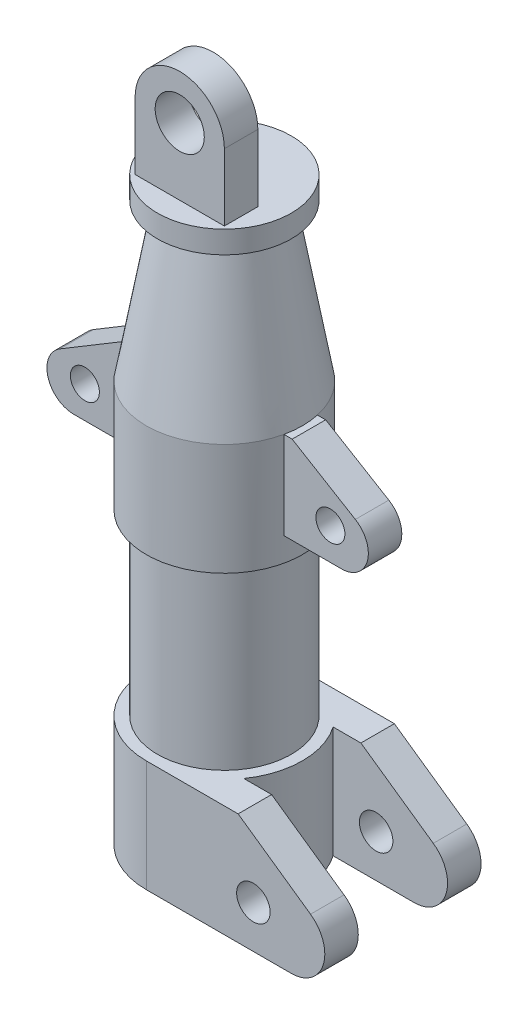
from build123d import *

# Parameters (mm, degrees)
SKETCH2_R           = 7.5
BOSS_EXTRUDE1_DEPTH = 15
SKETCH3_R           = 6.5
BOSS_EXTRUDE2_DEPTH = 7.5
SKETCH4_R           = 11
BOSS_EXTRUDE3_DEPTH = 15
SKETCH5_R           = 20
CUT_EXTRUDE1_DEPTH  = 235


with BuildPart() as part:
    # Sketch1 → Revolve1 (revolve)
    with BuildSketch(Plane.XY):
        Polygon((0, 0), (35, 0), (35, 50), (30, 50), (30, 130), (35, 130), (35, 180), (22.65711135, 250), (30, 250), (30, 260), (0, 260), align=None)
    revolve(axis=Axis((0, 0, 0), (0, 1, 0)))

    # Sketch2 → Boss-Extrude1 (add)
    with BuildSketch(Plane.XY.offset(35)):
        with BuildLine():
            Line((0, 0), (48, 0))
            Line((48, 0), (65, 0))
            ThreePointArc((65, 0), (79.305754261, 10.489413007), (73.603646545, 27.287280664))
            Line((73.603646545, 27.287280664), (41.166521698, 50))
            Line((41.166521698, 50), (0, 50))
            Line((0, 50), (0, 0))
        make_face()
        with Locations((48, 19)):
            Circle(SKETCH2_R, mode=Mode.SUBTRACT)
    boss_extrude1 = extrude(amount=-BOSS_EXTRUDE1_DEPTH)

    # Mirror1: Boss-Extrude1 across plane
    add(boss_extrude1.mirror(Plane.XY))

    # Sketch3 → Boss-Extrude2 (add, symmetric)
    with BuildSketch(Plane.XY):
        with BuildLine():
            Line((0, 180), (0, 140.71))
            Line((0, 140.71), (55, 140.71))
            Line((55, 140.71), (60, 140.71))
            ThreePointArc((60, 140.71), (71.563565439, 149.503139487), (66.180456899, 162.996007608))
            Line((66.180456899, 162.996007608), (37.881061244, 180))
            Line((37.881061244, 180), (0, 180))
        make_face()
        with Locations((55, 155)):
            Circle(SKETCH3_R, mode=Mode.SUBTRACT)
    boss_extrude2 = extrude(amount=BOSS_EXTRUDE2_DEPTH, both=True)

    # Mirror2: Boss-Extrude2 across plane
    add(boss_extrude2.mirror(Plane(origin=(0, 0, 0), x_dir=(0, 0, 1), z_dir=(1, 0, 0))))

    # Sketch4 → Boss-Extrude3 (add)
    with BuildSketch(Plane.XY.offset(5)):
        with BuildLine():
            Line((-20, 290), (-20, 258.467022151))
            Line((-20, 258.467022151), (20, 258.467022151))
            Line((20, 258.467022151), (20, 290))
            ThreePointArc((20, 290), (0, 310), (-20, 290))
        make_face()
        with Locations((0, 290)):
            Circle(SKETCH4_R, mode=Mode.SUBTRACT)
    extrude(amount=BOSS_EXTRUDE3_DEPTH)

    # Sketch5 → Cut-Extrude1 (cut)
    with BuildSketch(Plane.XZ):
        Circle(SKETCH5_R)
    extrude(amount=-CUT_EXTRUDE1_DEPTH, mode=Mode.SUBTRACT)


solid = part.part
